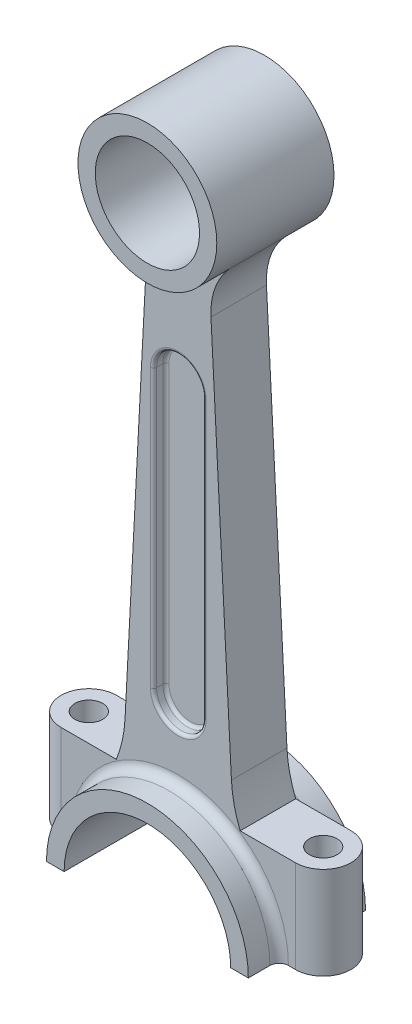
from build123d import *

# Parameters (mm, degrees)
SKETCH1_R               = 22.5
SKETCH1_R_2             = 16.9
BOSS_EXTRUDE4_DEPTH     = 19
BOSS_EXTRUDE4_2_DEPTH   = 19
BOSS_EXTRUDE5_DEPTH     = 9
CUT_EXTRUDE1_DEPTH      = 4
FILLET1_R               = 1
FILLET2_R               = 40
FILLET3_R               = 22.5
BOSS_EXTRUDE6_DEPTH     = 30
CUT_EXTRUDE2_DEPTH      = 209.505251732
CUT_EXTRUDE2_DEPTH_BACK = 209.505251732
CUT_EXTRUDE3_DEPTH      = 201.224099449
CUT_EXTRUDE3_DEPTH_BACK = 201.224099449
SKETCH13_R              = 4.5
FILLET4_R               = 3


with BuildPart() as part:
    # Sketch1 → Boss-Extrude4 (new, symmetric)
    with BuildSketch(Plane.XY):
        Circle(SKETCH1_R)
        Circle(SKETCH1_R_2, mode=Mode.SUBTRACT)
    extrude(amount=BOSS_EXTRUDE4_DEPTH, both=True)



with BuildPart() as body_2:
    # Sketch1 → Boss-Extrude4 2 (new, symmetric)
    with BuildSketch(Plane.XY):
        with BuildLine():
            Line((-32.721104737, -201.2), (-27, -201.2))
            ThreePointArc((-27, -201.2), (0, -174.2), (27, -201.2))
            Line((27, -201.2), (32.721104737, -201.2))
            ThreePointArc((32.721104737, -201.2), (0, -168.478895263), (-32.721104737, -201.2))
        make_face()
    extrude(amount=BOSS_EXTRUDE4_2_DEPTH, both=True)


with BuildPart() as part_1:
    add(part.part)

    add(body_2.part)  # Boss-Extrude5 merges body 2
    # Sketch1<6> → Boss-Extrude5 (add, symmetric)
    with BuildSketch(Plane.XY):
        with BuildLine():
            ThreePointArc((10, -20.155644371), (5.135562367, -21.906072199), (0, -22.5))
            Line((0, -22.5), (0, -168.478895263))
            ThreePointArc((0, -168.478895263), (9.429008016, -169.866878498), (18.05808552, -173.913075611))
            Line((18.05808552, -173.913075611), (10, -20.155644371))
        make_face()
        with BuildLine():
            Line((0, -168.478895263), (0, -22.5))
            ThreePointArc((0, -22.5), (-5.135562367, -21.906072199), (-10, -20.155644371))
            Line((-10, -20.155644371), (-18.05808552, -173.913075611))
            ThreePointArc((-18.05808552, -173.913075611), (-9.429008016, -169.866878498), (0, -168.478895263))
        make_face()
    extrude(amount=BOSS_EXTRUDE5_DEPTH, both=True)

    # Sketch3 → Cut-Extrude1 (cut)
    with BuildSketch(Plane.XY.offset(9)):
        with BuildLine():
            Line((-8, -145.6), (-8, -55.6))
            ThreePointArc((-8, -55.6), (0, -47.6), (8, -55.6))
            Line((8, -55.6), (8, -145.6))
            ThreePointArc((8, -145.6), (0, -153.6), (-8, -145.6))
        make_face()
    cut_extrude1 = extrude(amount=-CUT_EXTRUDE1_DEPTH, mode=Mode.SUBTRACT)

    # Mirror1: Cut-Extrude1 across plane
    add(cut_extrude1.mirror(Plane.XY), mode=Mode.SUBTRACT)

    # Fillet1
    fillet1_edges = [part_1.edges().sort_by_distance(p)[0] for p in [
        (0, -153.6, 5),
        (-8, -100.6, 5),
        (0, -47.6, 5),
        (8, -100.6, 5),
        (0, -153.6, 9),
        (8, -100.6, 9),
        (0, -47.6, 9),
        (-8, -100.6, 9),
        (0, -153.6, -9),
        (8, -100.6, -9),
        (0, -47.6, -9),
        (-8, -100.6, -9),
        (0, -153.6, -5),
        (8, -100.6, -5),
        (0, -47.6, -5),
        (-8, -100.6, -5),
    ]]
    fillet(fillet1_edges, radius=FILLET1_R)

    # Fillet2
    fillet2_edges = [part_1.edges().sort_by_distance(p)[0] for p in [
        (-18.05808552, -173.913075611, 0),
        (18.05808552, -173.913075611, 0),
    ]]
    fillet(fillet2_edges, radius=FILLET2_R)

    # Fillet3
    fillet3_edges = [part_1.edges().sort_by_distance(p)[0] for p in [
        (10, -20.155644371, 0),
        (-10, -20.155644371, 0),
    ]]
    fillet(fillet3_edges, radius=FILLET3_R)

    # Sketch11 → Boss-Extrude6 (add)
    with BuildSketch(Plane(origin=(0, -171.2, 0), x_dir=(1, 0, 0), z_dir=(0, 1, 0))):
        with BuildLine():
            Line((-38, 9), (38, 9))
            ThreePointArc((38, 9), (47, 0), (38, -9))
            Line((38, -9), (-38, -9))
            ThreePointArc((-38, -9), (-47, 0), (-38, 9))
        make_face()
    extrude(amount=-BOSS_EXTRUDE6_DEPTH)

    # Sketch12 → Cut-Extrude2 (cut, two sides: drawn at the far end of the back side and taken through both)
    with BuildSketch(Plane.XY.offset(9).offset(-CUT_EXTRUDE2_DEPTH_BACK)):
        with BuildLine():
            Line((-27, -201.2), (27, -201.2))
            ThreePointArc((27, -201.2), (0, -174.2), (-27, -201.2))
        make_face()
    extrude(amount=CUT_EXTRUDE2_DEPTH + CUT_EXTRUDE2_DEPTH_BACK, mode=Mode.SUBTRACT)

    # Sketch13 → Cut-Extrude3 (cut, two sides: drawn at the far end of the back side and taken through both)
    with BuildSketch(Plane(origin=(0, -171.2, 0), x_dir=(1, 0, 0), z_dir=(0, 1, 0)).offset(-CUT_EXTRUDE3_DEPTH_BACK)):
        with Locations(Location((-38, 0, 0), (0, 0, 270))):
            Circle(SKETCH13_R)
        with Locations(Location((38, 0, 0), (0, 0, 270))):
            Circle(SKETCH13_R)
    extrude(amount=CUT_EXTRUDE3_DEPTH + CUT_EXTRUDE3_DEPTH_BACK, mode=Mode.SUBTRACT)

    # Fillet4
    fillet4_edges = [part_1.edges().sort_by_distance(p)[0] for p in [
        (0, -168.478895263, 9),
        (0, -168.478895263, -9),
    ]]
    fillet(fillet4_edges, radius=FILLET4_R)


solid = part_1.part
